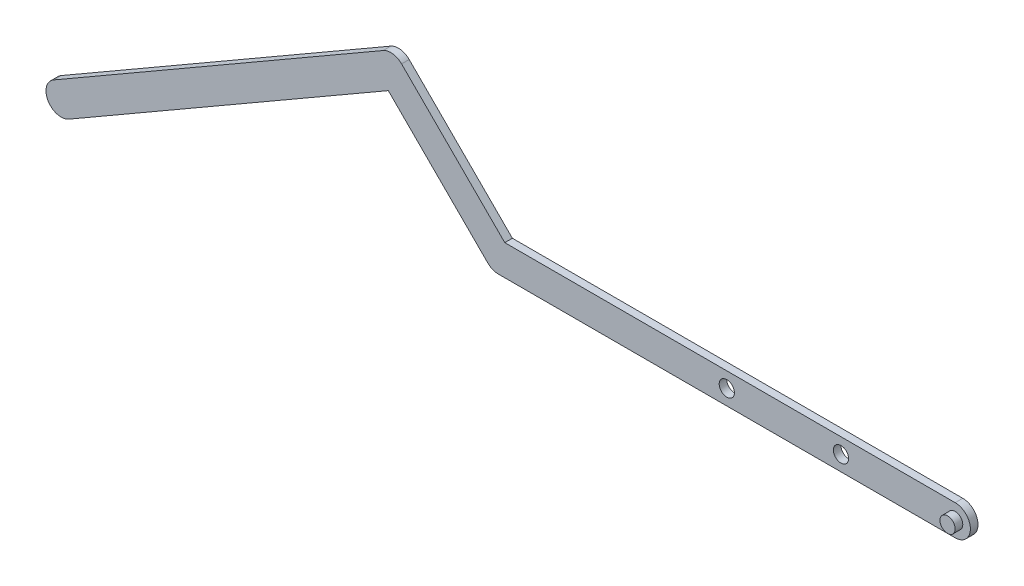
from build123d import *

# Parameters (mm, degrees)
SKETCH_1_R      = 1
EXTRUDE_1_DEPTH = 1
SKETCH_2_R      = 1
EXTRUDE_2_DEPTH = 1


with BuildPart() as part:
    # 草图1 → 凸台-拉伸1 (new body)
    with BuildSketch(Plane.XY):
        with BuildLine():
            Line((0, 2), (30, 2))
            ThreePointArc((30, 2), (32, 0), (30, -2))
            Line((30, -2), (0, -2))
            Line((0, -2), (-30, -2))
            ThreePointArc((-30, -2), (-30.765366865, -1.847759065), (-31.414213562, -1.414213562))
            Line((-31.414213562, -1.414213562), (-44.471184953, 11.642757828))
            Line((-44.471184953, 11.642757828), (-86.443405813, -12.589915184))
            ThreePointArc((-86.443405813, -12.589915184), (-89.175456621, -11.857864376), (-88.443405813, -9.125813569))
            Line((-88.443405813, -9.125813569), (-45.142135624, 15.874186431))
            ThreePointArc((-45.142135624, 15.874186431), (-43.881083239, 16.125025346), (-42.727922061, 15.556349186))
            Line((-42.727922061, 15.556349186), (-29.171572875, 2))
            Line((-29.171572875, 2), (0, 2))
        make_face()
        with Locations((15, 0)):
            Circle(SKETCH_1_R, mode=Mode.SUBTRACT)
        Circle(SKETCH_1_R, mode=Mode.SUBTRACT)
    extrude(amount=EXTRUDE_1_DEPTH)

    # 草图2 → 凸台-拉伸2 (add)
    with BuildSketch(Plane.XY.offset(1)):
        with Locations((30, 0)):
            Circle(SKETCH_2_R)
    extrude(amount=EXTRUDE_2_DEPTH)


solid = part.part
